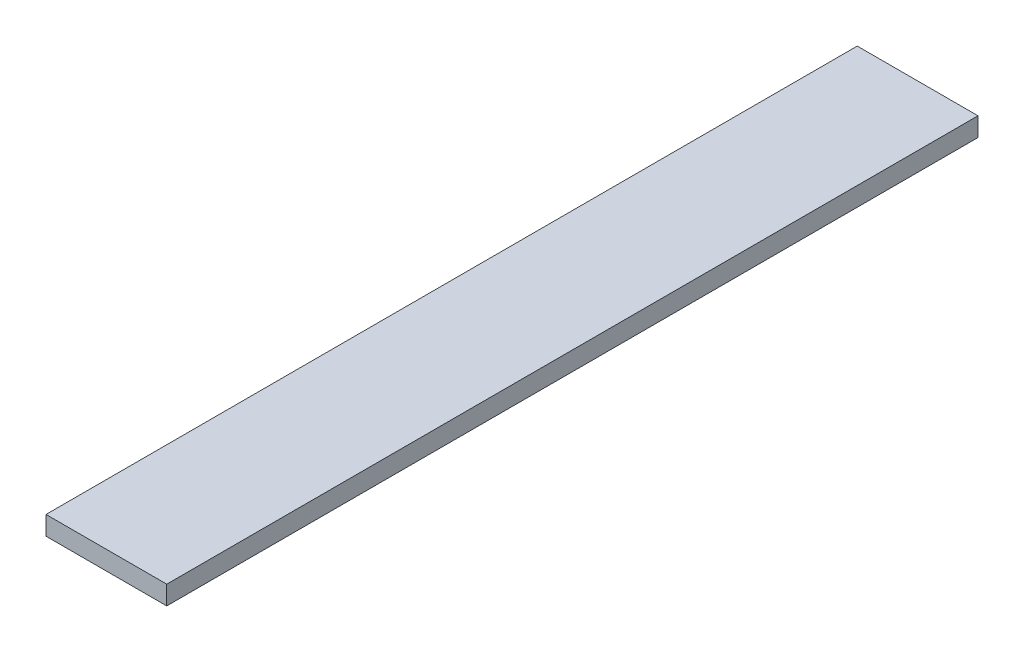
from build123d import *

# Parameters (mm, degrees)
ESBO_O1_W                = 96
ESBO_O1_H                = 15
RESSALTO_EXTRUS_O1_DEPTH = 645


with BuildPart() as part:
    # Esboço1 → Ressalto-extrusão1 (new body)
    with BuildSketch(Plane.XY):
        Rectangle(ESBO_O1_W, ESBO_O1_H)
    extrude(amount=RESSALTO_EXTRUS_O1_DEPTH)


solid = part.part
